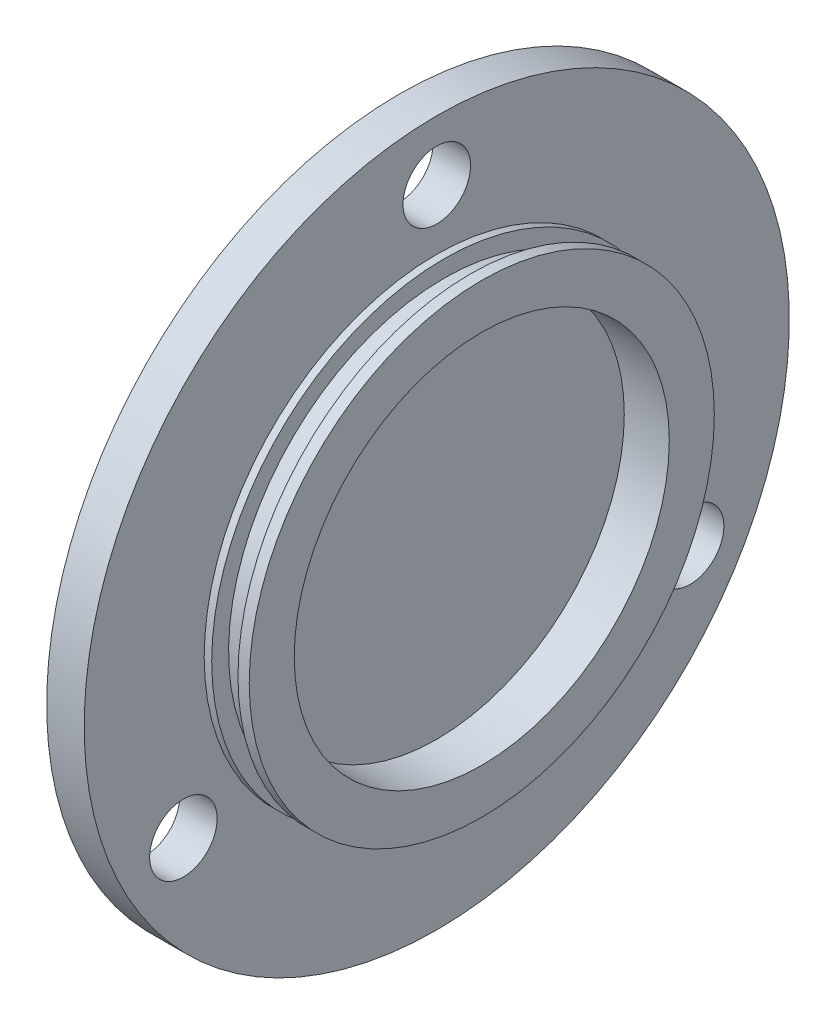
from build123d import *

# Parameters (mm, degrees)
SCHIZZO2_R               = 4.5
TAGLIO_ESTRUSIONE1_DEPTH = 67.738294854


with BuildPart() as part:
    # Schizzo1 → Rivoluzione1 (revolve)
    with BuildSketch(Plane.XY):
        Polygon((0, 0), (0, 47), (5, 47), (5, 31), (6, 31), (6, 28.75), (9.5, 28.75), (9.5, 31), (11, 31), (11, 25), (5, 25), (5, 0), align=None)
    revolve(axis=Axis((5, 0, 0), (-1, 0, 0)))

    # Schizzo2 → Taglio-Estrusione1 (cut, through all)
    with BuildSketch(Plane(origin=(5, 0, 0), x_dir=(0, 0, -1), z_dir=(1, 0, 0))):
        with Locations(Location((0, 39, 0), (0, 0, 90))):
            Circle(SCHIZZO2_R)
        with Locations(Location((33.774990748, -19.5, 0), (0, 0, 90))):
            Circle(SCHIZZO2_R)
        with Locations(Location((-33.774990748, -19.5, 0), (0, 0, 90))):
            Circle(SCHIZZO2_R)
    extrude(amount=-TAGLIO_ESTRUSIONE1_DEPTH, mode=Mode.SUBTRACT)


solid = part.part
